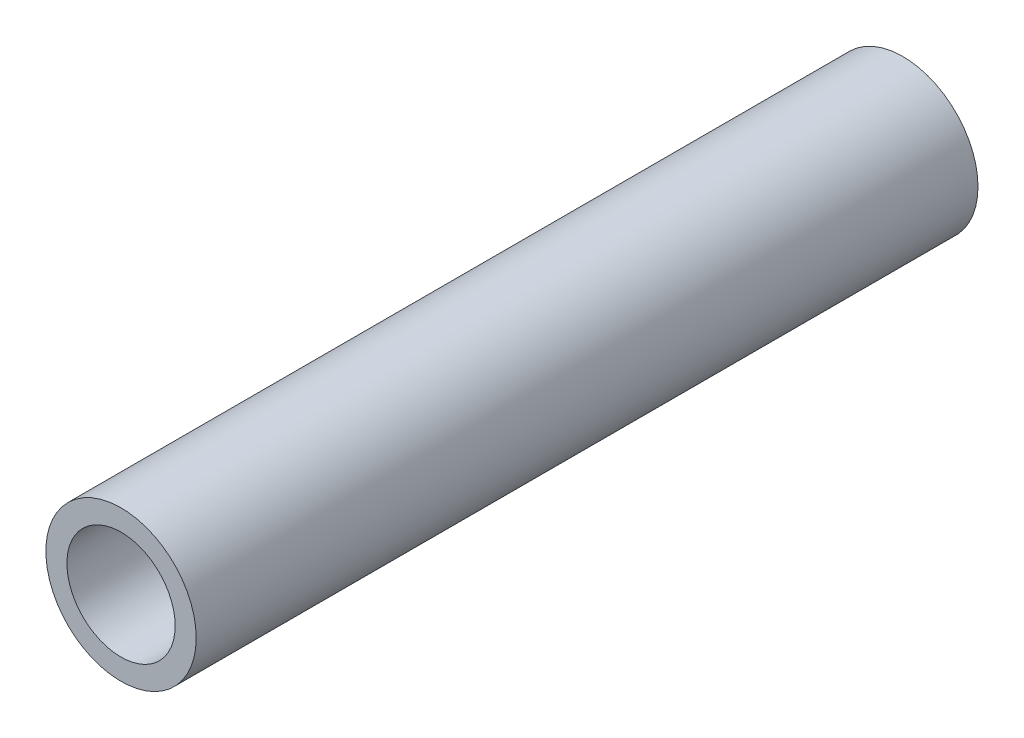
from build123d import *

# Parameters (mm, degrees)
SKETCH_1_R      = 6.25
SKETCH_1_R_2    = 4.5
EXTRUDE_1_DEPTH = 65


with BuildPart() as part:
    # Эскиз1 → Бобышка-Вытянуть1 (new body)
    with BuildSketch(Plane.XY):
        Circle(SKETCH_1_R)
        Circle(SKETCH_1_R_2, mode=Mode.SUBTRACT)
    extrude(amount=EXTRUDE_1_DEPTH)


solid = part.part
